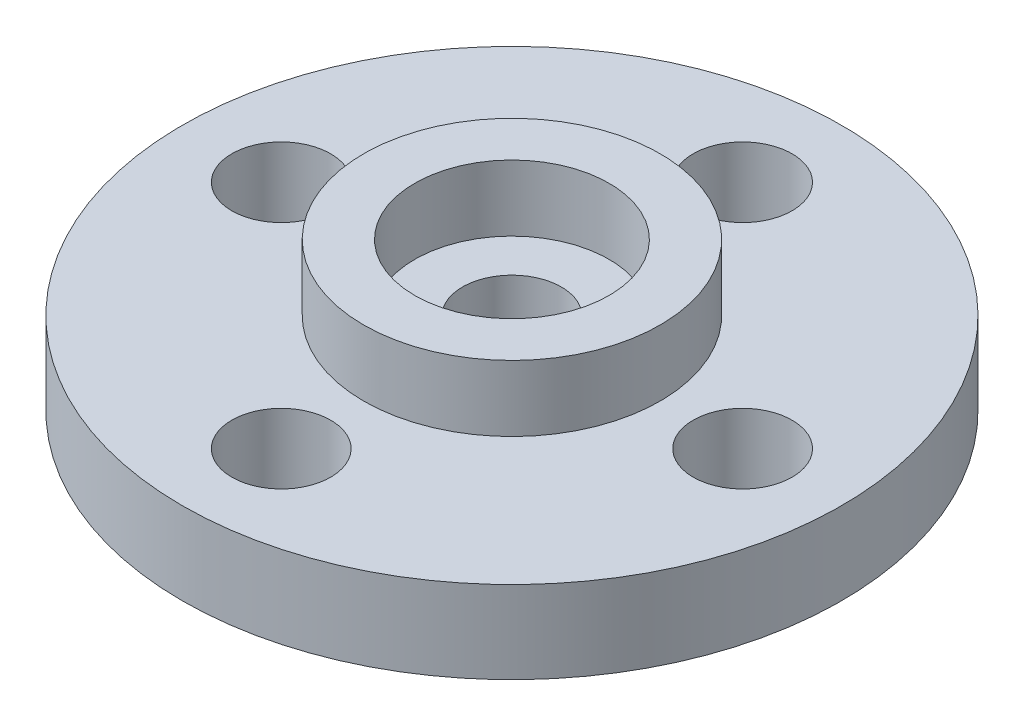
from build123d import *

# Parameters (mm, degrees)
SKETCH_1_R      = 10
SKETCH_1_R_2    = 1.5
EXTRUDE_1_DEPTH = 2.5
SKETCH_2_R      = 4.5
SKETCH_2_R_2    = 2.95
EXTRUDE_2_DEPTH = 2


with BuildPart() as part:
    # 草图1 → 凸台-拉伸1 (new body)
    with BuildSketch(Plane(origin=(0, 0, 0), x_dir=(1, 0, 0), z_dir=(0, 1, 0))):
        with Locations(Location((0, 0, 0), (0, 0, 270))):
            Circle(SKETCH_1_R)
        with Locations(Location((0, 0, 0), (0, 0, 270))):
            Circle(SKETCH_1_R_2, mode=Mode.SUBTRACT)
        with Locations(Location((0, 7, 0), (0, 0, 270))):
            Circle(SKETCH_1_R_2, mode=Mode.SUBTRACT)
        with Locations(Location((7, 0, 0), (0, 0, 270))):
            Circle(SKETCH_1_R_2, mode=Mode.SUBTRACT)
        with Locations(Location((0, -7, 0), (0, 0, 270))):
            Circle(SKETCH_1_R_2, mode=Mode.SUBTRACT)
        with Locations(Location((-7, 0, 0), (0, 0, 270))):
            Circle(SKETCH_1_R_2, mode=Mode.SUBTRACT)
    extrude(amount=EXTRUDE_1_DEPTH)

    # 草图2 → 凸台-拉伸2 (add)
    with BuildSketch(Plane(origin=(0, 2.5, 0), x_dir=(1, 0, 0), z_dir=(0, 1, 0))):
        with Locations(Location((0, 0, 0), (0, 0, 270))):
            Circle(SKETCH_2_R)
        with Locations(Location((0, 0, 0), (0, 0, 270))):
            Circle(SKETCH_2_R_2, mode=Mode.SUBTRACT)
    extrude(amount=EXTRUDE_2_DEPTH)


solid = part.part
